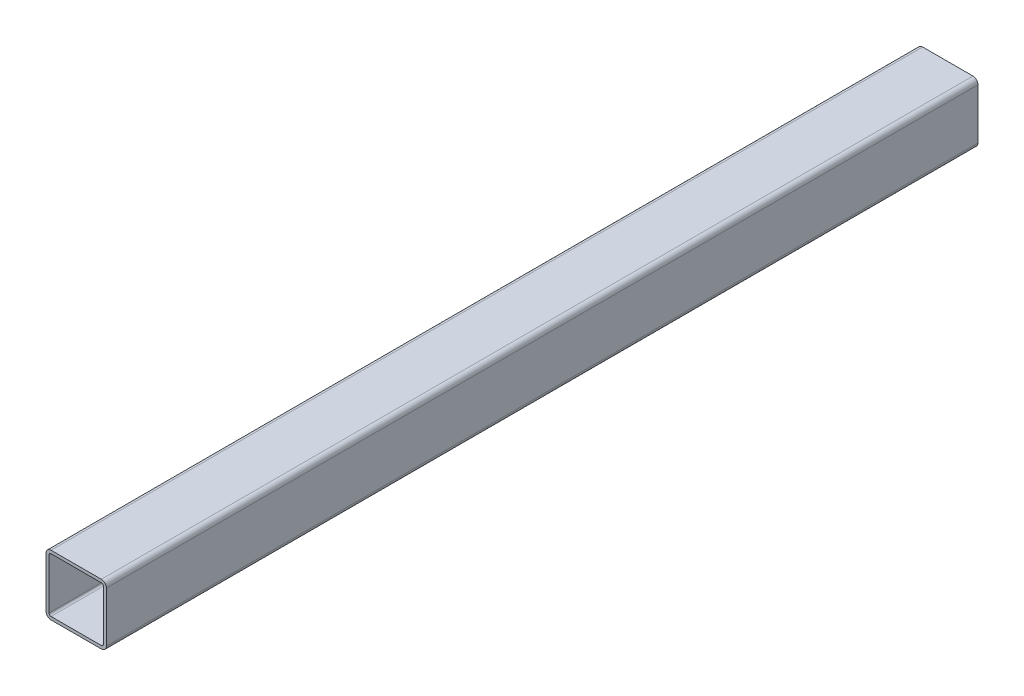
from build123d import *

# Parameters (mm, degrees)
EXTRUDE_1_DEPTH = 433
SHELL_1_T       = -3


with BuildPart() as part:
    # Эскиз1 → Бобышка-Вытянуть1 (new, symmetric)
    with BuildSketch(Plane.XY):
        with BuildLine():
            Line((-25, -30), (25, -30))
            ThreePointArc((25, -30), (28.535533906, -28.535533906), (30, -25))
            Line((30, -25), (30, 25))
            ThreePointArc((30, 25), (28.535533906, 28.535533906), (25, 30))
            Line((25, 30), (-25, 30))
            ThreePointArc((-25, 30), (-28.535533906, 28.535533906), (-30, 25))
            Line((-30, 25), (-30, -25))
            ThreePointArc((-30, -25), (-28.535533906, -28.535533906), (-25, -30))
        make_face()
    extrude(amount=EXTRUDE_1_DEPTH, both=True)

    # Оболочка1
    shell_1_openings = [part.faces().sort_by_distance(p)[0] for p in [
        (0, 0, 433),
        (0, 0, -433),
    ]]
    offset(amount=SHELL_1_T, openings=shell_1_openings, kind=Kind.INTERSECTION)


solid = part.part
